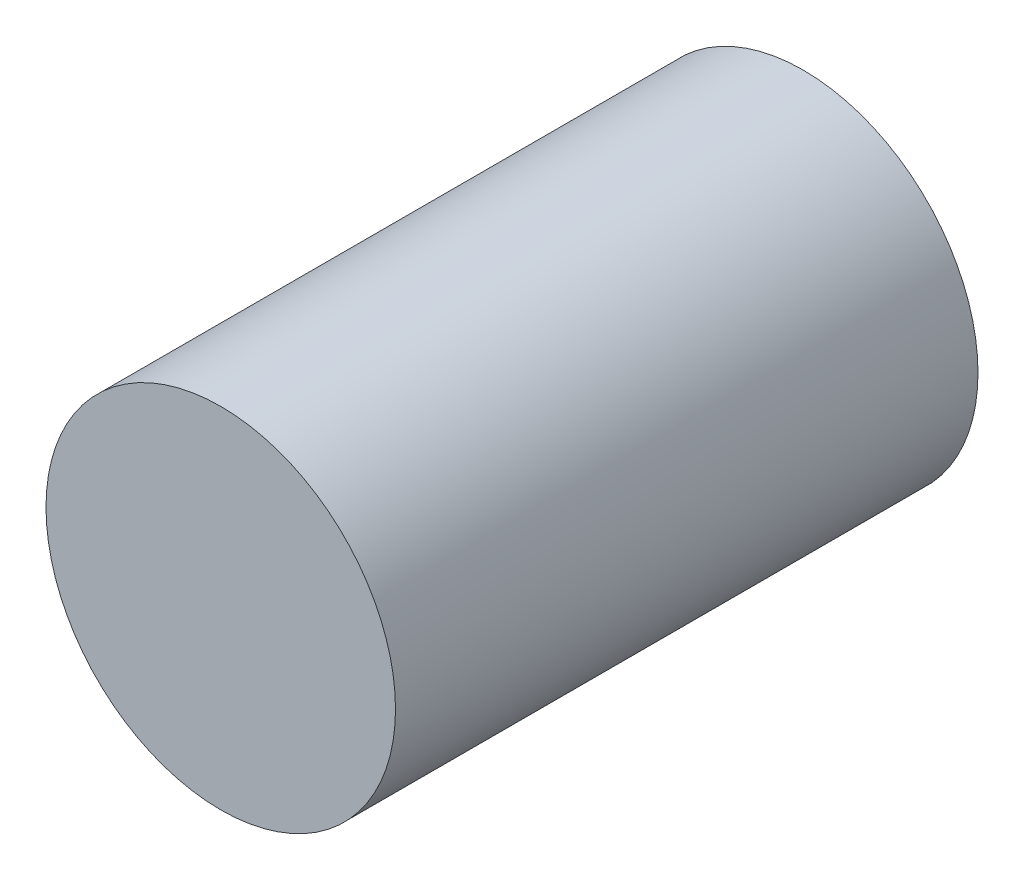
from build123d import *

# Parameters (mm, degrees)
SKETCH_1_R      = 1.5
EXTRUDE_1_DEPTH = 5


with BuildPart() as part:
    # 草图1 → 凸台-拉伸1 (new body)
    with BuildSketch(Plane.XY):
        Circle(SKETCH_1_R)
    extrude(amount=EXTRUDE_1_DEPTH)


solid = part.part
